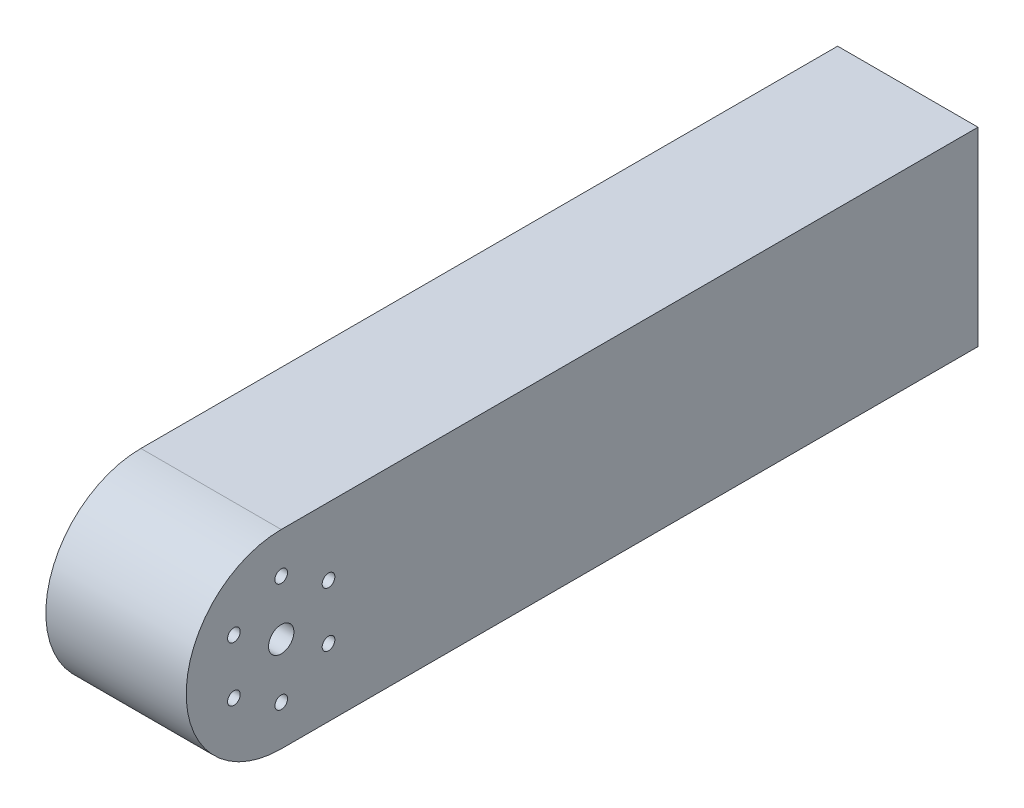
from build123d import *

# Parameters (mm, degrees)
SKETCH_1_W          = 250
SKETCH_1_H          = 60
EXTRUDE_2_DEPTH     = 44.32
FILLET_2_RADIUS     = 30
FILLET_2_LENGTH     = 44.32
SKETCH_2_R          = 1
EXTRUDE_3_DEPTH     = 3
SKETCH_3_R          = 2
CUT_EXTRUDE_1_DEPTH = 44.32
SKETCH_4_R          = 4
CUT_EXTRUDE_2_DEPTH = 103


with BuildPart() as part:
    # 草图1 → 凸台-拉伸2 (new body)
    with BuildSketch(Plane(origin=(0, 0, 0), x_dir=(0, 0, -1), z_dir=(1, 0, 0))):
        Rectangle(SKETCH_1_W, SKETCH_1_H)
    extrude(amount=EXTRUDE_2_DEPTH)

    # 圆角2: full round fillet: the end face becomes a half cylinder, R = half its width
    fillet_2_face = Plane((22.16, 0, 125), x_dir=(1, 0, 0), z_dir=(0, 0, 1))  # on the end face: x along it, z out of the body
    fillet_2_slab = fillet_2_face.offset(-FILLET_2_RADIUS / 2) * Box(FILLET_2_LENGTH, 2 * FILLET_2_RADIUS, FILLET_2_RADIUS, mode=Mode.PRIVATE)  # the body's end, R deep
    fillet_2_round = Plane((22.16, 0, 95), x_dir=(0, 0, 1), z_dir=(1, 0, 0)) * Cylinder(FILLET_2_RADIUS, FILLET_2_LENGTH, mode=Mode.PRIVATE)  # its axis R under the face
    add(fillet_2_slab - fillet_2_round, mode=Mode.SUBTRACT)

    # 草图2 → 凸台-拉伸3 (add)
    with BuildSketch(Plane(origin=(0, 0, -125), x_dir=(-1, 0, 0), z_dir=(0, 0, -1))):
        with Locations(Location((-22.436932243, 0, 0), (0, 0, 270))):
            Circle(SKETCH_2_R)
    extrude(amount=EXTRUDE_3_DEPTH)

    # 草图3 → 切除-拉伸1 (cut)
    with BuildSketch(Plane.ZY):
        with Locations((95, 17.25)):
            Circle(SKETCH_3_R)
        with Locations((109.938938215, 8.625)):
            Circle(SKETCH_3_R)
        with Locations((109.938938215, -8.625)):
            Circle(SKETCH_3_R)
        with Locations((95, -17.25)):
            Circle(SKETCH_3_R)
        with Locations((80.061061785, -8.625)):
            Circle(SKETCH_3_R)
        with Locations((80.061061785, 8.625)):
            Circle(SKETCH_3_R)
    extrude(amount=-CUT_EXTRUDE_1_DEPTH, mode=Mode.SUBTRACT)

    # 草图4 → 切除-拉伸2 (cut)
    with BuildSketch(Plane.ZY):
        with Locations((95, 0)):
            Circle(SKETCH_4_R)
    extrude(amount=-CUT_EXTRUDE_2_DEPTH, mode=Mode.SUBTRACT)


solid = part.part
